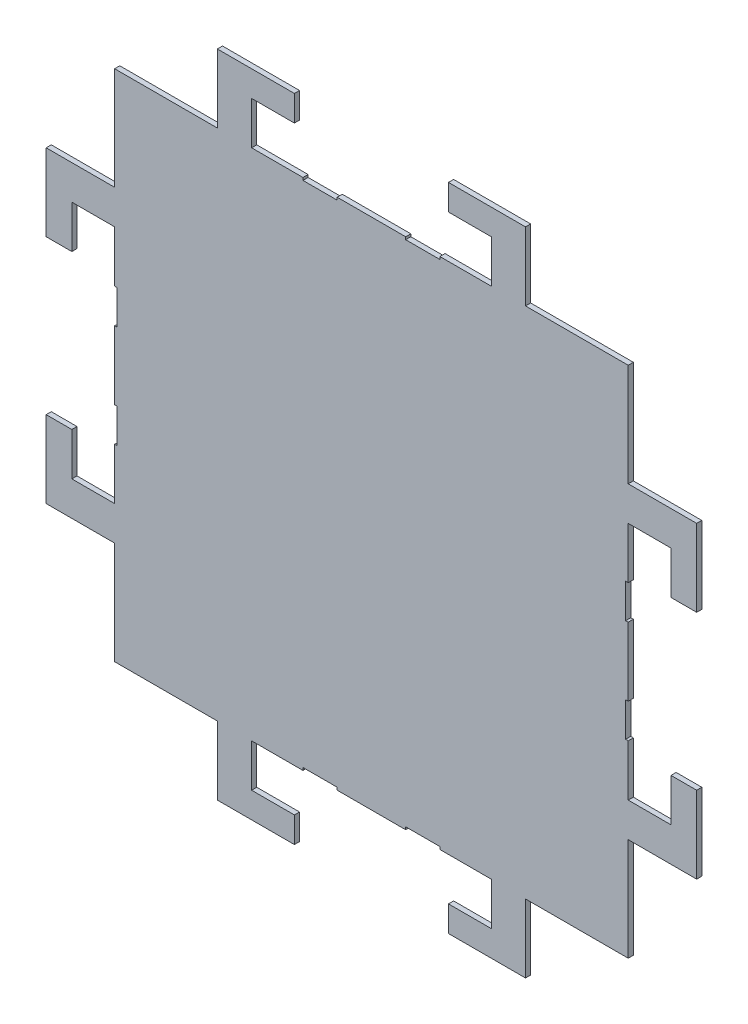
from build123d import *

# Parameters (mm, degrees)
RESSALTO_EXTRUS_O1_DEPTH = 3


with BuildPart() as part:
    # Esboço1 → Ressalto-extrusão1 (new body)
    with BuildSketch(Plane.XY):
        Polygon((-240, -190), (-240, -130), (-280, -130), (-280, -85), (-265, -85), (-265, -110), (-240, -110), (-240, -80), (-238.5, -80), (-238.5, -60), (-240, -60), (-240, -20), (-238.5, -20), (-238.5, 0), (-240, 0), (-240, 30), (-265, 30), (-265, 5), (-280, 5), (-280, 50), (-240, 50), (-240, 110), (-180, 110), (-180, 150), (-135, 150), (-135, 135), (-160, 135), (-160, 110), (-130, 110), (-130, 108.5), (-110, 108.5), (-110, 110), (-70, 110), (-70, 108.5), (-50, 108.5), (-50, 110), (-20, 110), (-20, 135), (-45, 135), (-45, 150), (0, 150), (0, 110), (60, 110), (60, 50), (100, 50), (100, 5), (85, 5), (85, 30), (60, 30), (60, 0), (58.5, 0), (58.5, -20), (60, -20), (60, -60), (58.5, -60), (58.5, -80), (60, -80), (60, -110), (85, -110), (85, -85), (100, -85), (100, -130), (60, -130), (60, -190), (0, -190), (0, -230), (-45, -230), (-45, -215), (-20, -215), (-20, -190), (-50, -190), (-50, -188.5), (-70, -188.5), (-70, -190), (-110, -190), (-110, -188.5), (-130, -188.5), (-130, -190), (-160, -190), (-160, -215), (-135, -215), (-135, -230), (-180, -230), (-180, -190), align=None)
    extrude(amount=RESSALTO_EXTRUS_O1_DEPTH)


solid = part.part
